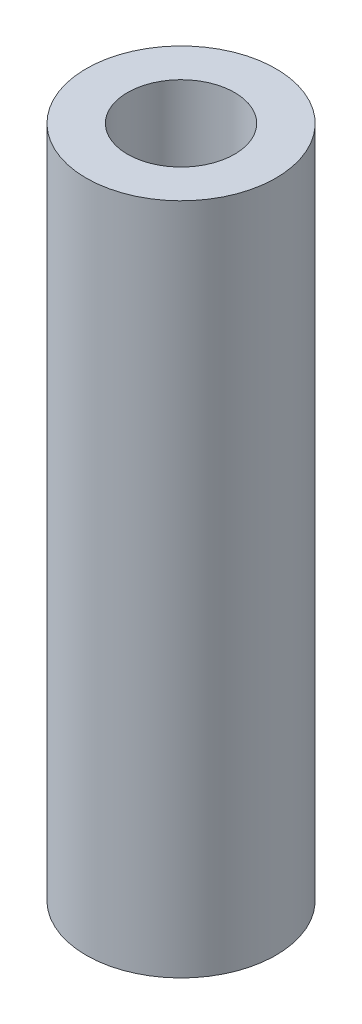
from build123d import *

# Parameters (mm, degrees)
SZKIC1_W = 27
SZKIC1_H = 440


with BuildPart() as part:
    # Szkic1 → Obrót1 (revolve)
    with BuildSketch(Plane.XY, mode=Mode.PRIVATE) as obr_t1_sk:
        with Locations((48.5, 0)):
            Rectangle(SZKIC1_W, SZKIC1_H)
    revolve(obr_t1_sk.sketch.rotate(Axis((0, 344.744344029, 0), (0, -1, 0)), 90), axis=Axis((0, 344.744344029, 0), (0, -1, 0)))


solid = part.part
